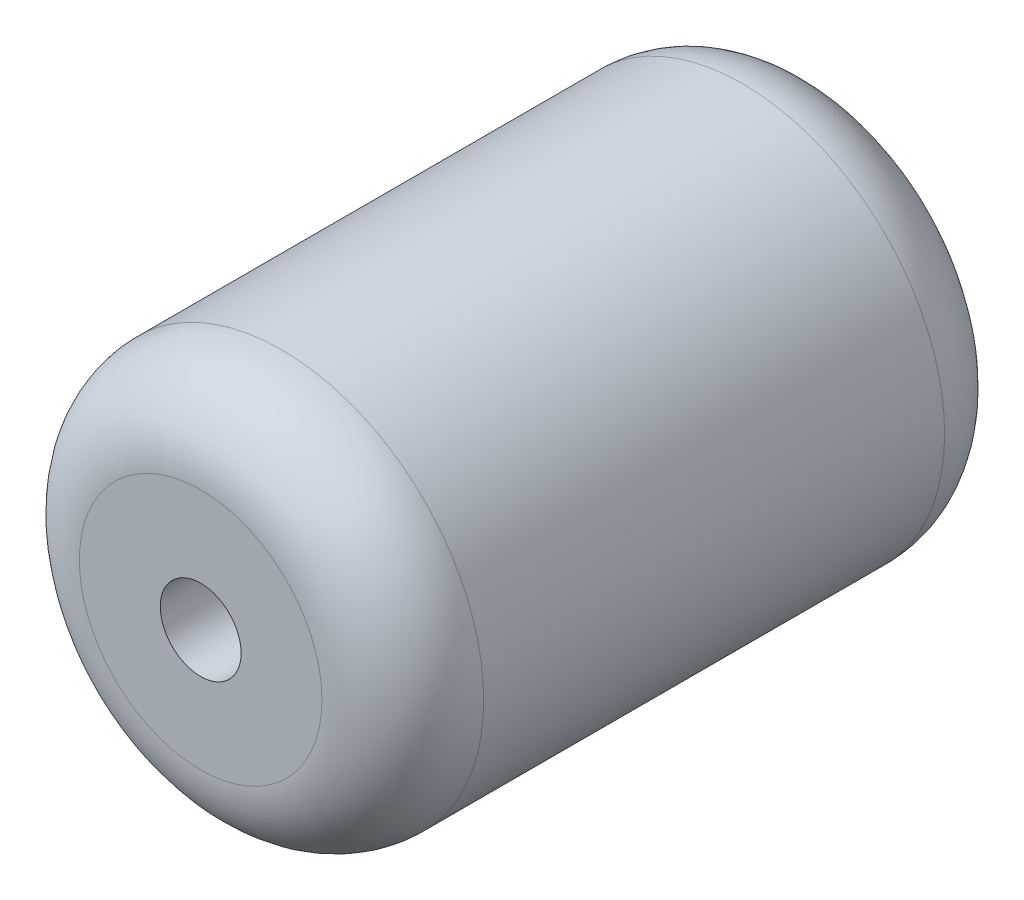
from build123d import *

# Parameters (mm, degrees)
CROQUIS1_R              = 25
CROQUIS1_R_2            = 5
SALIENTE_EXTRUIR1_DEPTH = 77
REDONDEO1_R             = 10


with BuildPart() as part:
    # Croquis1 → Saliente-Extruir1 (new body)
    with BuildSketch(Plane.XY):
        Circle(CROQUIS1_R)
        Circle(CROQUIS1_R_2, mode=Mode.SUBTRACT)
    extrude(amount=SALIENTE_EXTRUIR1_DEPTH)

    # Redondeo1
    redondeo1_edges = [part.edges().sort_by_distance(p)[0] for p in [
        (-25, 0, 0),
        (-25, 0, 77),
    ]]
    fillet(redondeo1_edges, radius=REDONDEO1_R)


solid = part.part
